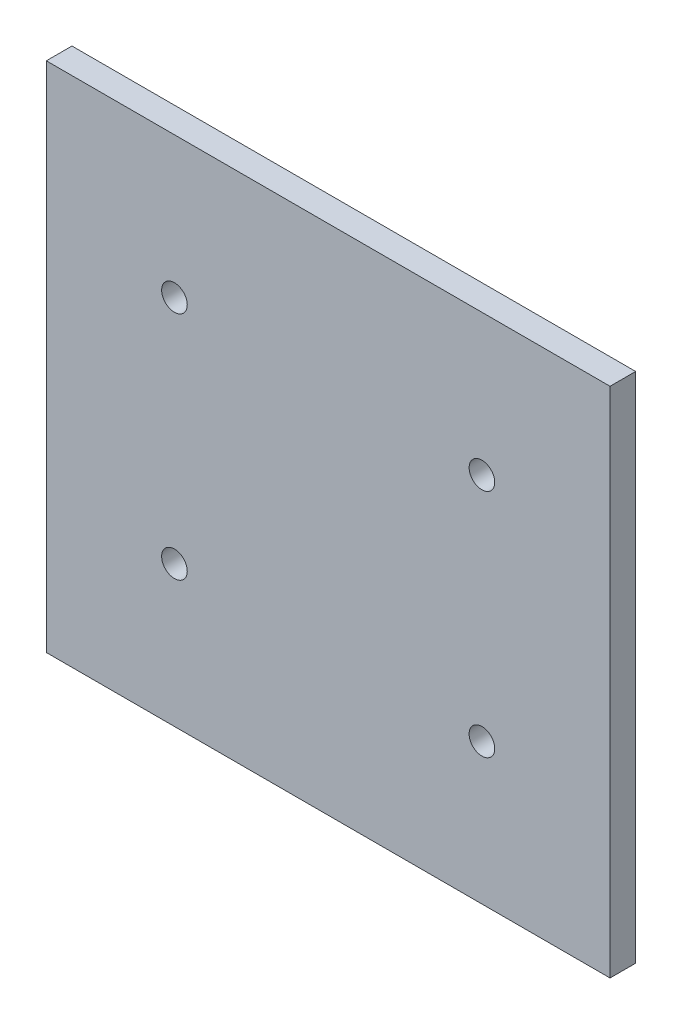
from build123d import *

# Parameters (mm, degrees)
SKETCH1_W           = 69.85
SKETCH1_H           = 63.5
SKETCH1_R           = 1.5875
BOSS_EXTRUDE1_DEPTH = 3.175


with BuildPart() as part:
    # Sketch1 → Boss-Extrude1 (new body)
    with BuildSketch(Plane.XY):
        with Locations((19.05, 14.2875)):
            Rectangle(SKETCH1_W, SKETCH1_H)
        with Locations((0, 28.575)):
            Circle(SKETCH1_R, mode=Mode.SUBTRACT)
        with Locations((38.1, 28.575)):
            Circle(SKETCH1_R, mode=Mode.SUBTRACT)
        with Locations((38.1, 0)):
            Circle(SKETCH1_R, mode=Mode.SUBTRACT)
        Circle(SKETCH1_R, mode=Mode.SUBTRACT)
    extrude(amount=BOSS_EXTRUDE1_DEPTH)


solid = part.part
